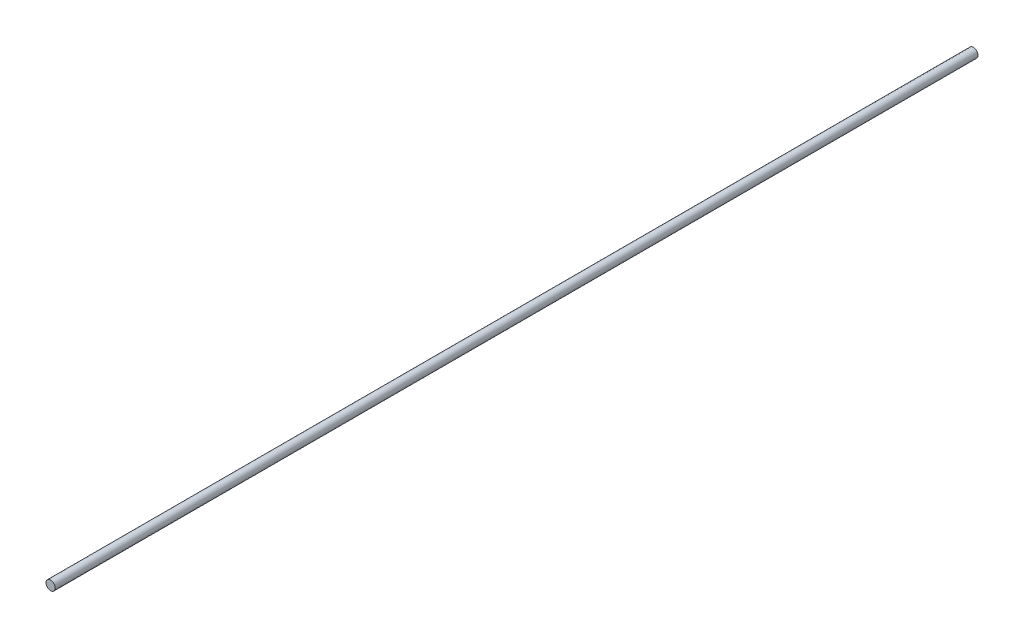
from build123d import *

# Parameters (mm, degrees)
SKETCH1_R           = 25
BOSS_EXTRUDE1_DEPTH = 5000


with BuildPart() as part:
    # Sketch1 → Boss-Extrude1 (new body)
    with BuildSketch(Plane.XY):
        Circle(SKETCH1_R)
    extrude(amount=BOSS_EXTRUDE1_DEPTH)


solid = part.part
